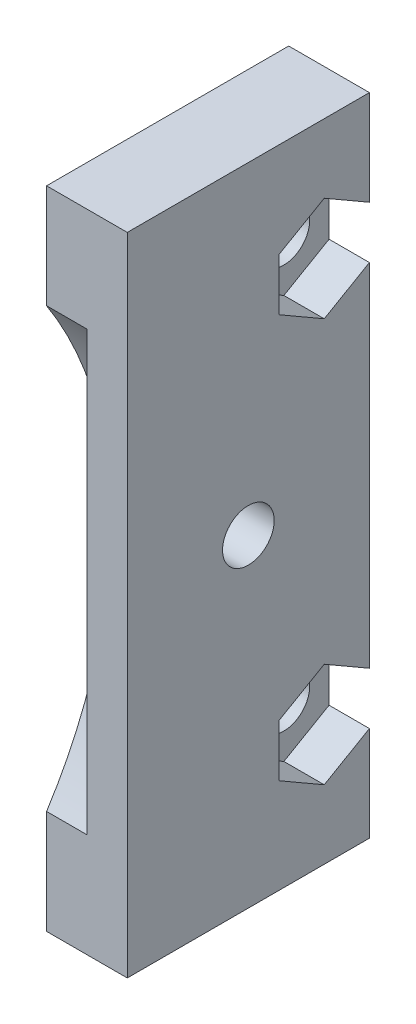
from build123d import *
from build123d.topology import SkipClean

# Parameters (mm, degrees)
SKETCH1_R           = 1.6
BOSS_EXTRUDE1_DEPTH = 2.5
BOSS_EXTRUDE2_START = -2.5
SKETCH1_3_W         = 15
SKETCH1_3_H         = 40
SKETCH1_3_R         = 1.6
BOSS_EXTRUDE2_DEPTH = 2.5
EXTRUDE_THIN1_START = 1
SKETCH2_R           = 2.6
SKETCH2_R_2         = 1.6
EXTRUDE_THIN1_DEPTH = 1
CUT_EXTRUDE1_DEPTH  = 2.5


with BuildPart() as part:
    # Sketch1 → Boss-Extrude1 (new body)
    with BuildSketch(Plane(origin=(0, 0, 0), x_dir=(0, 0, -1), z_dir=(1, 0, 0))):
        Polygon((15, 40), (0, 40), (0, 0), (15, 0), (15, 5.883419246), (12.2, 4.266838493), (9.4, 5.883419246), (9.4, 9.116580754), (12.2, 10.733161507), (15, 9.116580754), (15, 30.883419246), (12.2, 29.266838493), (9.4, 30.883419246), (9.4, 34.116580754), (12.2, 35.733161507), (15, 34.116580754), align=None)
        with Locations((7.5, 20)):
            Circle(SKETCH1_R, mode=Mode.SUBTRACT)
    extrude(amount=BOSS_EXTRUDE1_DEPTH)

    # Sketch1<3> → Boss-Extrude2 (add)
    with BuildSketch(Plane(origin=(0, 0, 0), x_dir=(0, 0, -1), z_dir=(1, 0, 0)).offset(BOSS_EXTRUDE2_START)):
        with Locations((7.5, 20)):
            Rectangle(SKETCH1_3_W, SKETCH1_3_H)
        with Locations((7.5, 20)):
            Circle(SKETCH1_3_R, mode=Mode.SUBTRACT)
        with Locations((12.2, 32.5)):
            Circle(SKETCH1_3_R, mode=Mode.SUBTRACT)
        with Locations((12.2, 7.5)):
            Circle(SKETCH1_3_R, mode=Mode.SUBTRACT)
    extrude(amount=BOSS_EXTRUDE2_DEPTH)

    # Sketch2 → Extrude-Thin1 (add)
    # profile 1 of 2: a face of its own
    with SkipClean():  # the faces are left unmerged after this step: merging them gives an invalid solid
        with BuildSketch(Plane.ZY.offset(2.5).offset(EXTRUDE_THIN1_START)):
            with Locations((-12.2, 7.5)):
                Circle(SKETCH2_R)
            with Locations((-12.2, 7.5)):
                Circle(SKETCH2_R_2, mode=Mode.SUBTRACT)
        # profile 2 of 2: a face of its own
        with BuildSketch(Plane.ZY.offset(2.5).offset(EXTRUDE_THIN1_START)):
            with Locations((-12.2, 32.5)):
                Circle(SKETCH2_R)
            with Locations((-12.2, 32.5)):
                Circle(SKETCH2_R_2, mode=Mode.SUBTRACT)
        extrude(amount=-EXTRUDE_THIN1_DEPTH)

    # Sketch3 → Cut-Extrude1 (cut)
    with SkipClean():  # the faces are left unmerged after this step: merging them gives an invalid solid
        with BuildSketch(Plane.ZY.offset(2.5)):
            with BuildLine():
                ThreePointArc((0, 33.564659966), (-4, 20), (0, 6.435340034))
                Line((0, 6.435340034), (0, 33.564659966))
            make_face()
        extrude(amount=-CUT_EXTRUDE1_DEPTH, mode=Mode.SUBTRACT)


solid = part.part
